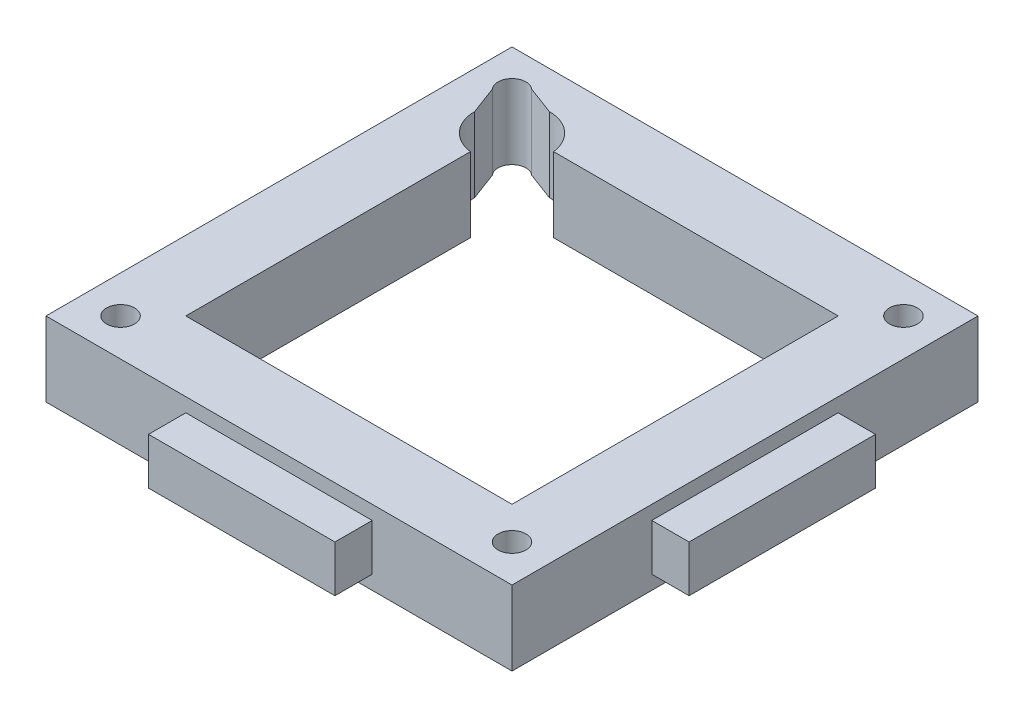
from build123d import *

# Parameters (mm, degrees)
SKETCH1_W         = 50
SKETCH1_H         = 50
SKETCH1_R         = 1.5
SUPPORT_DEPTH     = 8
SOUTH_START       = 25
SKETCH2_W         = 20
SKETCH2_H         = 5
SOUTH_DOWEL_DEPTH = 4
WEST_START        = 25
SKETCH3_W         = 20
SKETCH3_H         = 5
WEST_DOWEL_DEPTH  = 4


with BuildPart() as part:
    # Sketch1 → Support (new body)
    with BuildSketch(Plane(origin=(0, 0, 0), x_dir=(1, 0, 0), z_dir=(0, 1, 0))):
        Rectangle(SKETCH1_W, SKETCH1_H)
        with Locations(Location((-21, -21, 0), (0, 0, 270))):
            Circle(SKETCH1_R, mode=Mode.SUBTRACT)
        with Locations(Location((21, -21, 0), (0, 0, 270))):
            Circle(SKETCH1_R, mode=Mode.SUBTRACT)
        with BuildLine():
            Line((-13.031373033, 17.5), (17.5, 17.5))
            Line((17.5, 17.5), (17.5, -17.5))
            Line((17.5, -17.5), (-17.5, -17.5))
            Line((-17.5, -17.5), (-17.5, 13.031373033))
            ThreePointArc((-17.5, 13.031373033), (-20, 14.354248689), (-21, 17))
            Line((-21, 17), (-22.130136986, 20.01369863))
            ThreePointArc((-22.130136986, 20.01369863), (-22.060660172, 22.060660172), (-20.01369863, 22.130136986))
            Line((-20.01369863, 22.130136986), (-17, 21))
            ThreePointArc((-17, 21), (-14.354248689, 20), (-13.031373033, 17.5))
        make_face(mode=Mode.SUBTRACT)
        with Locations(Location((21, 21, 0), (0, 0, 270))):
            Circle(SKETCH1_R, mode=Mode.SUBTRACT)
    extrude(amount=SUPPORT_DEPTH)

    # Sketch2 → South Dowel (add)
    with BuildSketch(Plane.XY.offset(SOUTH_START)):
        with Locations((0, 4)):
            Rectangle(SKETCH2_W, SKETCH2_H)
    extrude(amount=SOUTH_DOWEL_DEPTH)

    # Sketch3 → West Dowel (add)
    with BuildSketch(Plane(origin=(0, 0, 0), x_dir=(0, 0, -1), z_dir=(1, 0, 0)).offset(WEST_START)):
        with Locations((0, 4)):
            Rectangle(SKETCH3_W, SKETCH3_H)
    extrude(amount=WEST_DOWEL_DEPTH)


solid = part.part
